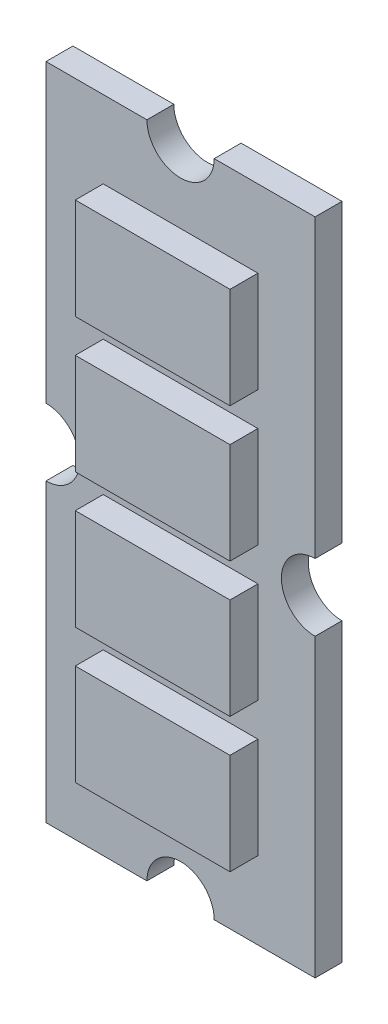
from build123d import *

# Parameters (mm, degrees)
EXTRUDE1_DEPTH = 0.8
SKETCH2_W      = 4.6
SKETCH2_H      = 3
EXTRUDE2_DEPTH = 0.83


with BuildPart() as part:
    # Sketch1 → Extrude1 (new body)
    with BuildSketch(Plane.XY):
        with BuildLine():
            Line((1.197612835, -16.845933624), (4.197612835, -16.845933624))
            Line((4.197612835, -16.845933624), (4.197612835, -25.645933624))
            ThreePointArc((4.197612835, -25.645933624), (3.197612835, -26.645933624), (4.197612835, -27.645933624))
            Line((4.197612835, -27.645933624), (4.197612835, -36.445933624))
            Line((4.197612835, -36.445933624), (1.197612835, -36.445933624))
            ThreePointArc((1.197612835, -36.445933624), (0.197612835, -35.445933624), (-0.802387165, -36.445933624))
            Line((-0.802387165, -36.445933624), (-3.802387165, -36.445933624))
            Line((-3.802387165, -36.445933624), (-3.802387165, -27.645933624))
            ThreePointArc((-3.802387165, -27.645933624), (-2.802387165, -26.645933624), (-3.802387165, -25.645933624))
            Line((-3.802387165, -25.645933624), (-3.802387165, -16.845933624))
            Line((-3.802387165, -16.845933624), (-0.802387165, -16.845933624))
            ThreePointArc((-0.802387165, -16.845933624), (0.197612835, -17.845933624), (1.197612835, -16.845933624))
        make_face()
    extrude(amount=EXTRUDE1_DEPTH)

    # Sketch2 → Extrude2 (add)
    with BuildSketch(Plane.XY.offset(0.8)):
        with Locations((0.197612835, -20.645933624)):
            Rectangle(SKETCH2_W, SKETCH2_H)
        with Locations((0.197612835, -32.645933624)):
            Rectangle(SKETCH2_W, SKETCH2_H)
        with Locations((0.197612835, -24.645933624)):
            Rectangle(SKETCH2_W, SKETCH2_H)
        with Locations((0.197612835, -28.645933624)):
            Rectangle(SKETCH2_W, SKETCH2_H)
    extrude(amount=EXTRUDE2_DEPTH)


solid = part.part
